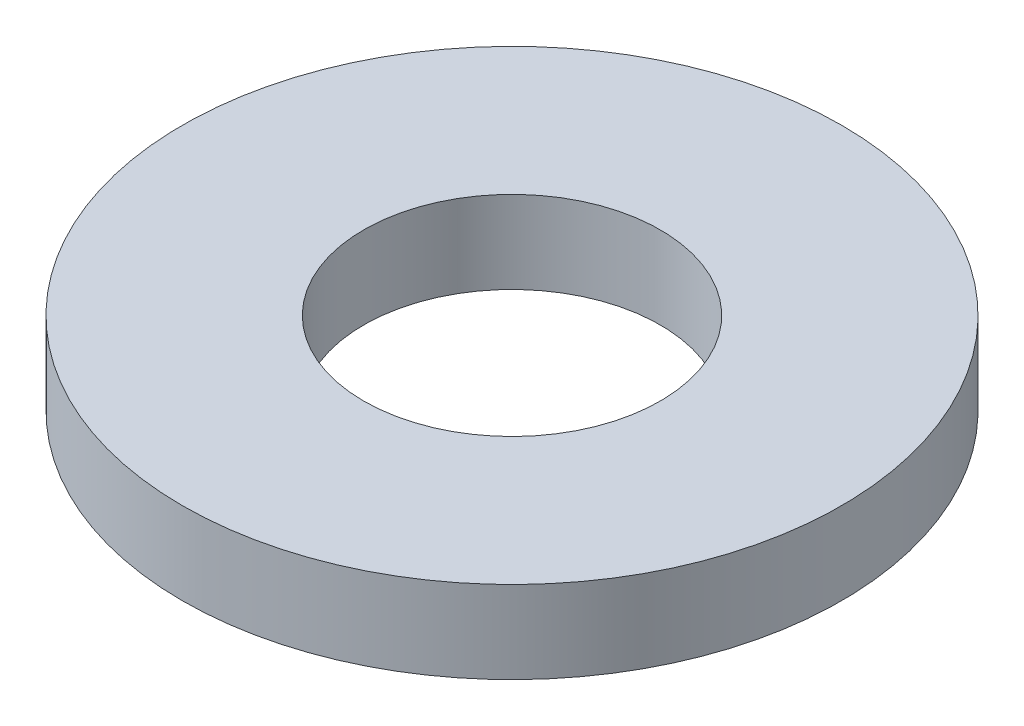
from build123d import *

# Parameters (mm, degrees)
SKETCH1_R           = 4
SKETCH1_R_2         = 1.8
BOSS_EXTRUDE1_DEPTH = 1


with BuildPart() as part:
    # Sketch1 → Boss-Extrude1 (new body)
    with BuildSketch(Plane(origin=(0, 0, 0), x_dir=(1, 0, 0), z_dir=(0, 1, 0))):
        with Locations(Location((0, 0, 0), (0, 0, 270))):
            Circle(SKETCH1_R)
        with Locations(Location((0, 0, 0), (0, 0, 270))):
            Circle(SKETCH1_R_2, mode=Mode.SUBTRACT)
    extrude(amount=BOSS_EXTRUDE1_DEPTH)


solid = part.part
